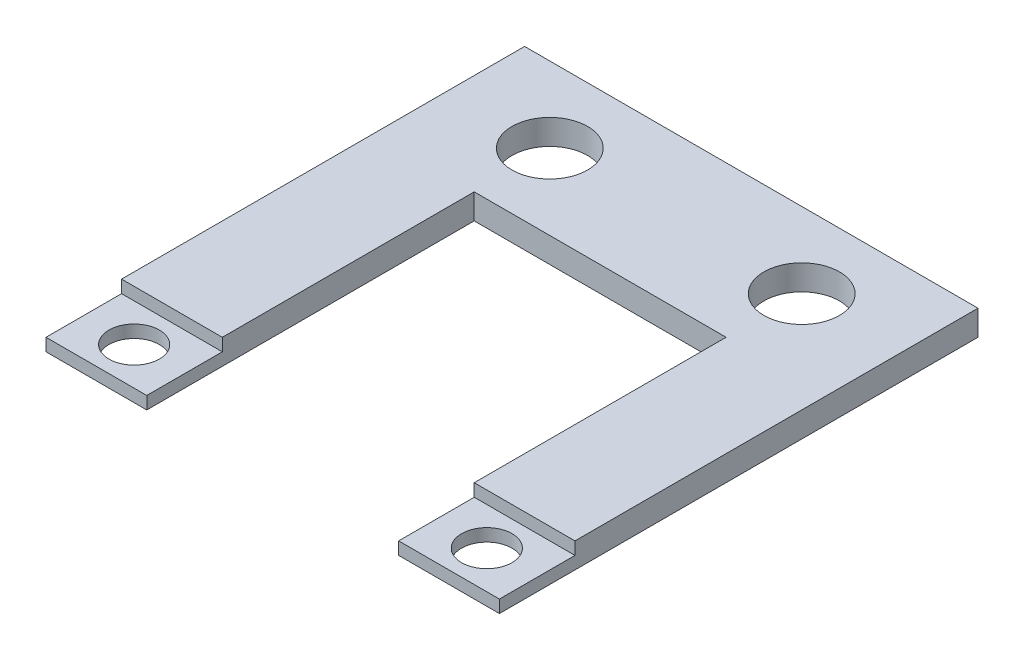
from build123d import *

# Parameters (mm, degrees)
BOSS_EXTRUDE1_DEPTH = 0.79375
SKETCH2_W           = 6.35
SKETCH2_H           = 4.7625
CUT_EXTRUDE1_DEPTH  = 0.79375
SKETCH3_R           = 1.5875
SKETCH3_R_2         = 2.38125
CUT_EXTRUDE2_DEPTH  = 1.5875


with BuildPart() as part:
    # Sketch1 → Boss-Extrude1 (new, symmetric)
    with BuildSketch(Plane(origin=(0, 0, 0), x_dir=(1, 0, 0), z_dir=(0, 1, 0))):
        Polygon((14.2875, 15.08125), (-14.2875, 15.08125), (-14.2875, -15.08125), (-7.9375, -15.08125), (-7.9375, 5.55625), (7.9375, 5.55625), (7.9375, -15.08125), (14.2875, -15.08125), align=None)
    extrude(amount=BOSS_EXTRUDE1_DEPTH, both=True)

    # Sketch2 → Cut-Extrude1 (cut)
    with BuildSketch(Plane(origin=(0, 0.79375, 0), x_dir=(1, 0, 0), z_dir=(0, 1, 0))):
        with Locations((-11.1125, -12.7)):
            Rectangle(SKETCH2_W, SKETCH2_H)
        with Locations((11.1125, -12.7)):
            Rectangle(SKETCH2_W, SKETCH2_H)
    extrude(amount=-CUT_EXTRUDE1_DEPTH, mode=Mode.SUBTRACT)

    # Sketch3 → Cut-Extrude2 (cut)
    with BuildSketch(Plane(origin=(0, 0.79375, 0), x_dir=(1, 0, 0), z_dir=(0, 1, 0))):
        with Locations(Location((-11.1125, -12.7, 0), (0, 0, 270))):
            Circle(SKETCH3_R)
        with Locations(Location((-7.9375, 10.31875, 0), (0, 0, 270))):
            Circle(SKETCH3_R_2)
        with Locations(Location((11.1125, -12.7, 0), (0, 0, 270))):
            Circle(SKETCH3_R)
        with Locations(Location((7.9375, 10.31875, 0), (0, 0, 270))):
            Circle(SKETCH3_R_2)
    extrude(amount=-CUT_EXTRUDE2_DEPTH, mode=Mode.SUBTRACT)


solid = part.part
